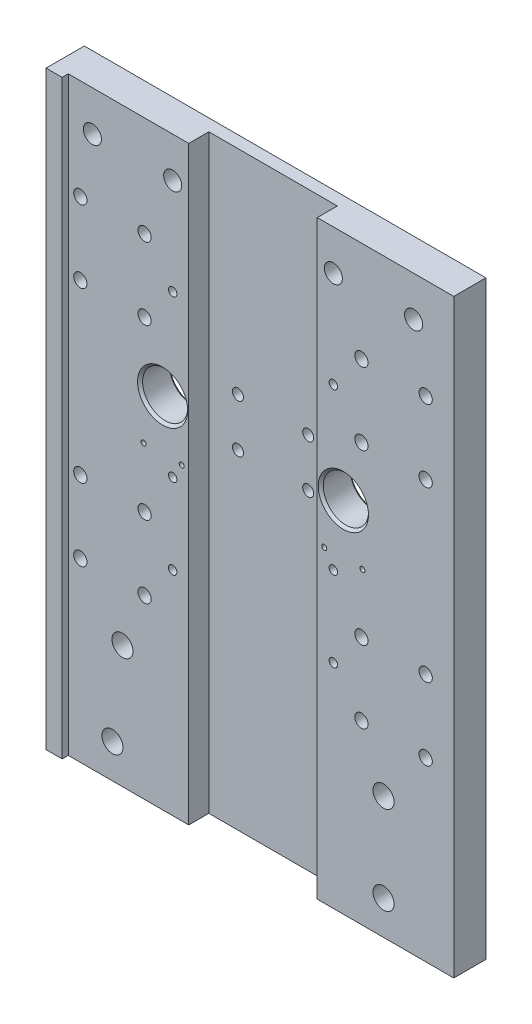
from build123d import *

# Parameters (mm, degrees)
SKETCH1_W                      = 200
SKETCH1_H                      = 294
BOSS_EXTRUDE1_DEPTH            = 19.05
SKETCH2_W                      = 192
SKETCH2_H                      = 294
CUT_EXTRUDE1_DEPTH             = 3.05
SKETCH3_W                      = 64
SKETCH3_H                      = 294
CUT_EXTRUDE2_DEPTH             = 10
M6_CLEARANCE_HOLE1_D           = 6.6
M3X0_5_TAPPED_HOLE1_AT_2_COUNT = 2
M3X0_5_TAPPED_HOLE1_AT_2_PITCH = 19
M8_CLEARANCE_HOLE1_D           = 9
M5X0_8_TAPPED_HOLE1_D          = 4.2
MIRROR2_COPY_1_D               = 6.6
M5_CLEARANCE_HOLE1_D           = 5.5
M12X1_5_TAPPED_HOLE1_D         = 10.5


with BuildPart() as part:
    # Sketch1 → Boss-Extrude1 (new body)
    with BuildSketch(Plane.XY):
        with Locations((0, -19)):
            Rectangle(SKETCH1_W, SKETCH1_H)
    extrude(amount=BOSS_EXTRUDE1_DEPTH)

    # Sketch2 → Cut-Extrude1 (cut)
    with BuildSketch(Plane.XY.offset(19.05)):
        with Locations((4, -19)):
            Rectangle(SKETCH2_W, SKETCH2_H)
    extrude(amount=-CUT_EXTRUDE1_DEPTH, mode=Mode.SUBTRACT)

    # Sketch3 → Cut-Extrude2 (cut)
    with BuildSketch(Plane.XY.offset(16)):
        with Locations((0, -19)):
            Rectangle(SKETCH3_W, SKETCH3_H)
    extrude(amount=-CUT_EXTRUDE2_DEPTH, mode=Mode.SUBTRACT)

    # M6 Clearance Hole1 (through all)
    with Locations(Plane.XY.offset(16)):
        with Locations((54, -42), (86, -42), (86, -78), (54, -78)):
            m6_clearance_hole1 = Hole(M6_CLEARANCE_HOLE1_D / 2)

    # Mirror1: M6 Clearance Hole1 across plane
    add(m6_clearance_hole1.mirror(Plane.ZX), mode=Mode.SUBTRACT)

    # Sketch8 → M3x0.5 Tapped Hole1 (revolve, cut)
    with BuildSketch(Plane(origin=(54.5, -12.5, 16), x_dir=(0, -1, 0), z_dir=(1, 0, 0))):
        Polygon((0, 0), (0, 8.251075774), (1.25, 7.5), (1.25, 0), align=None)
    m3x0_5_tapped_hole1 = revolve(axis=Axis((54.5, -12.5, 22.35), (0, 0, -1)), mode=Mode.SUBTRACT)

    # M3x0.5 Tapped Hole1 at 2: M3x0.5 Tapped Hole1 ×2
    with Locations(*[(-i * M3X0_5_TAPPED_HOLE1_AT_2_PITCH, 0, 0) for i in range(1, M3X0_5_TAPPED_HOLE1_AT_2_COUNT)]):
        add(m3x0_5_tapped_hole1, mode=Mode.SUBTRACT)

    # Sketch10 → Ø22.5 (22.5) Diameter Hole1 (revolve, cut)
    with BuildSketch(Plane(origin=(45, 12.5, 16), x_dir=(0, -1, 0), z_dir=(1, 0, 0))):
        Polygon((0, 0), (0, 16), (12.5, 16), (11.25, 14.75), (11.25, 1.25), (12.5, 0), align=None)
    f_22_5_22_5_diameter_hole1 = revolve(axis=Axis((45, 12.5, 22.35), (0, 0, -1)), mode=Mode.SUBTRACT)

    # M8 Clearance Hole1 (through all)
    with Locations(Plane.XY.offset(16)):
        with Locations((40, 108), (80, 108)):
            m8_clearance_hole1 = Hole(M8_CLEARANCE_HOLE1_D / 2)

    # M5x0.8 Tapped Hole1 (through all)
    with Locations(Plane.XY.offset(16)):
        with Locations((40, 60), (40, -20), (40, -60)):
            m5x0_8_tapped_hole1 = Hole(M5X0_8_TAPPED_HOLE1_D / 2)

    # Mirror2: M6 Clearance Hole1, M3x0.5 Tapped Hole1, Ø22.5 (22.5) Diameter Hole1, M8 Clearance Hole1, M5x0.8 Tapped Hole1 across plane
    add(m6_clearance_hole1.mirror(Plane(origin=(0, 0, 0), x_dir=(0, 0, 1), z_dir=(1, 0, 0))), mode=Mode.SUBTRACT)
    add(m3x0_5_tapped_hole1.mirror(Plane(origin=(0, 0, 0), x_dir=(0, 0, 1), z_dir=(1, 0, 0))), mode=Mode.SUBTRACT)
    add(f_22_5_22_5_diameter_hole1.mirror(Plane(origin=(0, 0, 0), x_dir=(0, 0, 1), z_dir=(1, 0, 0))), mode=Mode.SUBTRACT)
    add(m8_clearance_hole1.mirror(Plane(origin=(0, 0, 0), x_dir=(0, 0, 1), z_dir=(1, 0, 0))), mode=Mode.SUBTRACT)
    add(m5x0_8_tapped_hole1.mirror(Plane(origin=(0, 0, 0), x_dir=(0, 0, 1), z_dir=(1, 0, 0))), mode=Mode.SUBTRACT)

    # Mirror2 copy 1 (through all)
    with Locations(Plane(origin=(0, 0, 16), x_dir=(-1, 0, 0), z_dir=(0, 0, 1))):
        with Locations((54, -42), (86, -42), (86, -78), (54, -78)):
            Hole(MIRROR2_COPY_1_D / 2)

    # Mirror2 copy 2 sketch → Mirror2 copy 2 (revolve, cut)
    with BuildSketch(Plane(origin=(-35.5, -12.5, 16), x_dir=(0, -1, 0), z_dir=(-1, 0, 0))):
        Polygon((0, 0), (0, -8.251075774), (1.25, -7.5), (1.25, 0), align=None)
    revolve(axis=Axis((-35.5, -12.5, 22.35), (0, 0, 1)), mode=Mode.SUBTRACT)

    # M5 Clearance Hole1 (through all)
    with Locations(Plane.XY.offset(6)):
        with Locations((-17.5, 22), (17.5, 22), (17.5, -2), (-17.5, -2)):
            Hole(M5_CLEARANCE_HOLE1_D / 2)

    # M12x1.5 Tapped Hole1 (through all)
    with Locations(Plane.XY.offset(16)):
        with Locations((65, -149), (-65, -105), (65, -105), (-70, -149)):
            Hole(M12X1_5_TAPPED_HOLE1_D / 2)


solid = part.part
